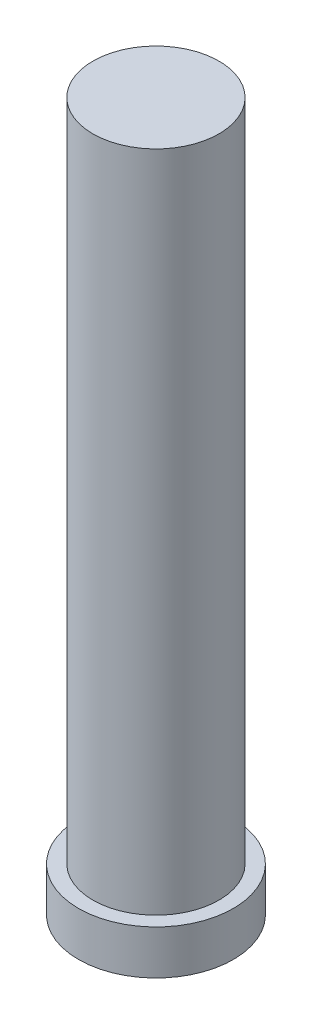
from build123d import *

# Parameters (mm, degrees)
SKETCH1_R           = 3.5
BOSS_EXTRUDE1_DEPTH = 2
SKETCH2_R           = 2.85
BOSS_EXTRUDE2_DEPTH = 30


with BuildPart() as part:
    # Sketch1 → Boss-Extrude1 (new body)
    with BuildSketch(Plane(origin=(0, 0, 0), x_dir=(1, 0, 0), z_dir=(0, 1, 0))):
        with Locations(Location((0, 0, 0), (0, 0, 270))):
            Circle(SKETCH1_R)
    extrude(amount=BOSS_EXTRUDE1_DEPTH)

    # Sketch2 → Boss-Extrude2 (add)
    with BuildSketch(Plane(origin=(0, 2, 0), x_dir=(1, 0, 0), z_dir=(0, 1, 0))):
        with Locations(Location((0, 0, 0), (0, 0, 270))):
            Circle(SKETCH2_R)
    extrude(amount=BOSS_EXTRUDE2_DEPTH)


solid = part.part
